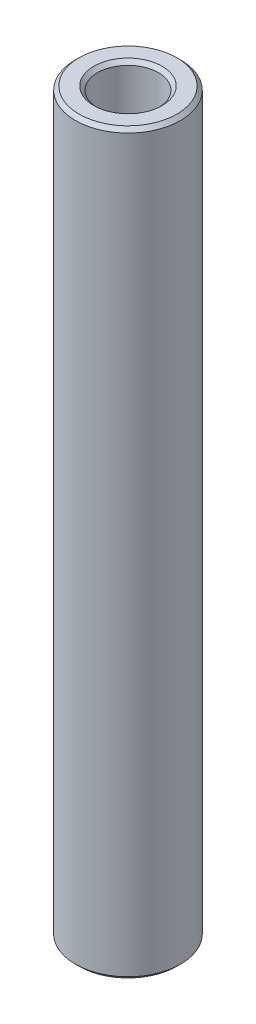
from build123d import *

# Parameters (mm, degrees)
IZIM1_R                     = 2.85
IZIM1_R_2                   = 1.65
Y_KSEKLIK_EKSTR_ZYON1_DEPTH = 40
PAH1_SIZE                   = 0.2


with BuildPart() as part:
    # Çizim1 → Yükseklik-Ekstrüzyon1 (new body)
    with BuildSketch(Plane(origin=(0, 0, 0), x_dir=(1, 0, 0), z_dir=(0, 1, 0))):
        with Locations(Location((0, 0, 0), (0, 0, 270))):
            Circle(IZIM1_R)
        with Locations(Location((0, 0, 0), (0, 0, 270))):
            Circle(IZIM1_R_2, mode=Mode.SUBTRACT)
    extrude(amount=Y_KSEKLIK_EKSTR_ZYON1_DEPTH)

    # Pah1
    pah1_edges = [part.edges().sort_by_distance(p)[0] for p in [
        (0, 0, -2.85),
        (0, 40, -2.85),
        (0, 0, -1.65),
        (0, 40, -1.65),
    ]]
    chamfer(pah1_edges, length=PAH1_SIZE)


solid = part.part
